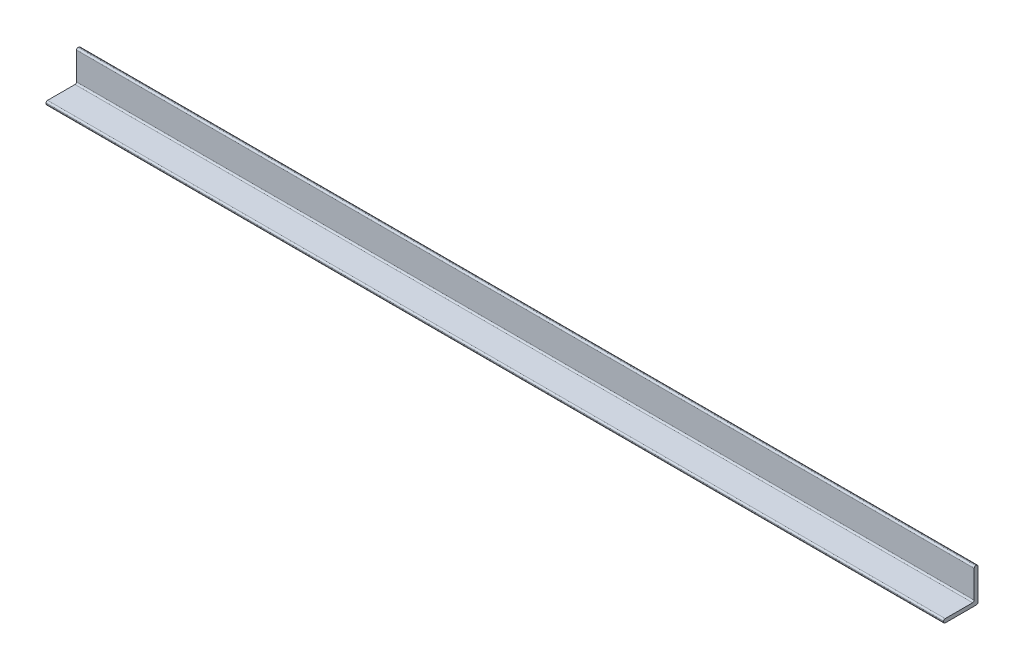
from build123d import *

# Parameters (mm, degrees)
SKETCH1_W           = 588
SKETCH1_H           = 22.5
BOSS_EXTRUDE1_DEPTH = 2.5
SKETCH2_W           = 588
SKETCH2_H           = 2.5
BOSS_EXTRUDE2_DEPTH = 20
FILLET1_R           = 1


with BuildPart() as part:
    # Sketch1 → Boss-Extrude1 (new body)
    with BuildSketch(Plane(origin=(0, 0, 0), x_dir=(1, 0, 0), z_dir=(0, 1, 0))):
        Rectangle(SKETCH1_W, SKETCH1_H)
    extrude(amount=BOSS_EXTRUDE1_DEPTH)

    # Sketch2 → Boss-Extrude2 (add)
    with BuildSketch(Plane(origin=(0, 2.5, 0), x_dir=(1, 0, 0), z_dir=(0, 1, 0))):
        with Locations((0, 10)):
            Rectangle(SKETCH2_W, SKETCH2_H)
    extrude(amount=BOSS_EXTRUDE2_DEPTH)

    # Fillet1
    fillet1_edges = [part.edges().sort_by_distance(p)[0] for p in [
        (0, 2.5, 11.25),
        (0, 2.5, -8.75),
        (0, 22.5, -8.75),
        (0, 22.5, -11.25),
        (0, 0, 11.25),
        (0, 0, -11.25),
    ]]
    fillet(fillet1_edges, radius=FILLET1_R)


solid = part.part
